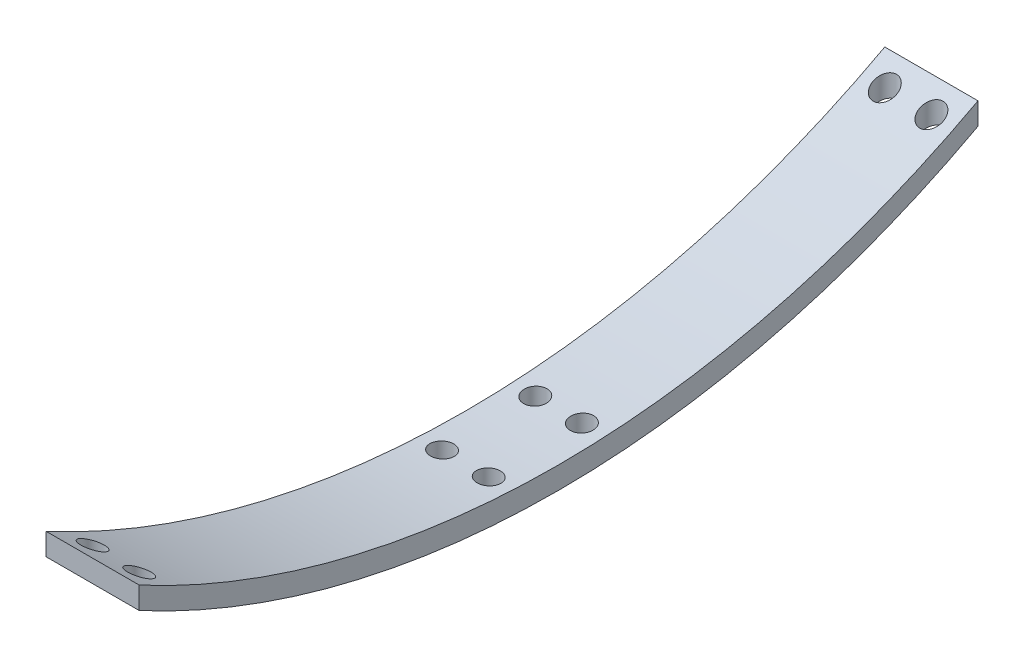
from build123d import *

# Parameters (mm, degrees)
BOSS_EXTRUDE4_DEPTH = 304.8
SKETCH4_OUTSIDE_W   = 384.928
SKETCH4_OUTSIDE_H   = 321.428
SKETCH4_OUTSIDE_W_2 = 25.4
SKETCH4_OUTSIDE_H_2 = 228.6
CUT_EXTRUDE2_DEPTH  = 150
SKETCH5_R           = 3.175
CUT_EXTRUDE3_DEPTH  = 150
SKETCH6_R           = 3.175
CUT_EXTRUDE4_DEPTH  = 150


with BuildPart() as part:
    # Sketch3 → Boss-Extrude4 (new body)
    with BuildSketch(Plane(origin=(0, 0, 0), x_dir=(0, 0, -1), z_dir=(1, 0, 0))):
        with BuildLine():
            ThreePointArc((232.90669496, 1.961354585), (112.25669496, -30.366715482), (-8.39330504, 1.961354585))
            Line((-8.39330504, 1.961354585), (-8.39330504, -4.052041589))
            ThreePointArc((-8.39330504, -4.052041589), (112.25669496, -36.380111656), (232.90669496, -4.052041589))
            Line((232.90669496, -4.052041589), (232.90669496, 1.961354585))
        make_face()
    extrude(amount=BOSS_EXTRUDE4_DEPTH)

    # Sketch4 outside → Cut-Extrude2 (cut)
    with BuildSketch(Plane(origin=(0, 1.961354585, 0), x_dir=(1, 0, 0), z_dir=(0, 1, 0))):
        with Locations((152.4, 112.257)):
            Rectangle(SKETCH4_OUTSIDE_W, SKETCH4_OUTSIDE_H)
        with Locations((41.389045768, 112.25669496)):
            Rectangle(SKETCH4_OUTSIDE_W_2, SKETCH4_OUTSIDE_H_2, mode=Mode.SUBTRACT)
    extrude(amount=-CUT_EXTRUDE2_DEPTH, mode=Mode.SUBTRACT)

    # Sketch5 → Cut-Extrude3 (cut)
    with BuildSketch(Plane(origin=(0, 1.961354585, 0), x_dir=(1, 0, 0), z_dir=(0, 1, 0))):
        with Locations(Location((47.739045768, 220.20669496, 0), (0, 0, 270))):
            Circle(SKETCH5_R)
        with Locations(Location((35.039045768, 220.20669496, 0), (0, 0, 270))):
            Circle(SKETCH5_R)
        with Locations(Location((35.039045768, 4.30669496, 0), (0, 0, 270))):
            Circle(SKETCH5_R)
        with Locations(Location((47.739045768, 4.30669496, 0), (0, 0, 270))):
            Circle(SKETCH5_R)
    extrude(amount=-CUT_EXTRUDE3_DEPTH, mode=Mode.SUBTRACT)

    # Sketch6 → Cut-Extrude4 (cut)
    with BuildSketch(Plane(origin=(0, 1.961354585, 0), x_dir=(1, 0, 0), z_dir=(0, 1, 0))):
        with Locations(Location((35.039045768, 124.95669496, 0), (0, 0, 270))):
            Circle(SKETCH6_R)
        with Locations(Location((47.739045768, 124.95669496, 0), (0, 0, 270))):
            Circle(SKETCH6_R)
        with Locations(Location((35.039045768, 99.55669496, 0), (0, 0, 270))):
            Circle(SKETCH6_R)
        with Locations(Location((47.739045768, 99.55669496, 0), (0, 0, 270))):
            Circle(SKETCH6_R)
    extrude(amount=-CUT_EXTRUDE4_DEPTH, mode=Mode.SUBTRACT)


solid = part.part
